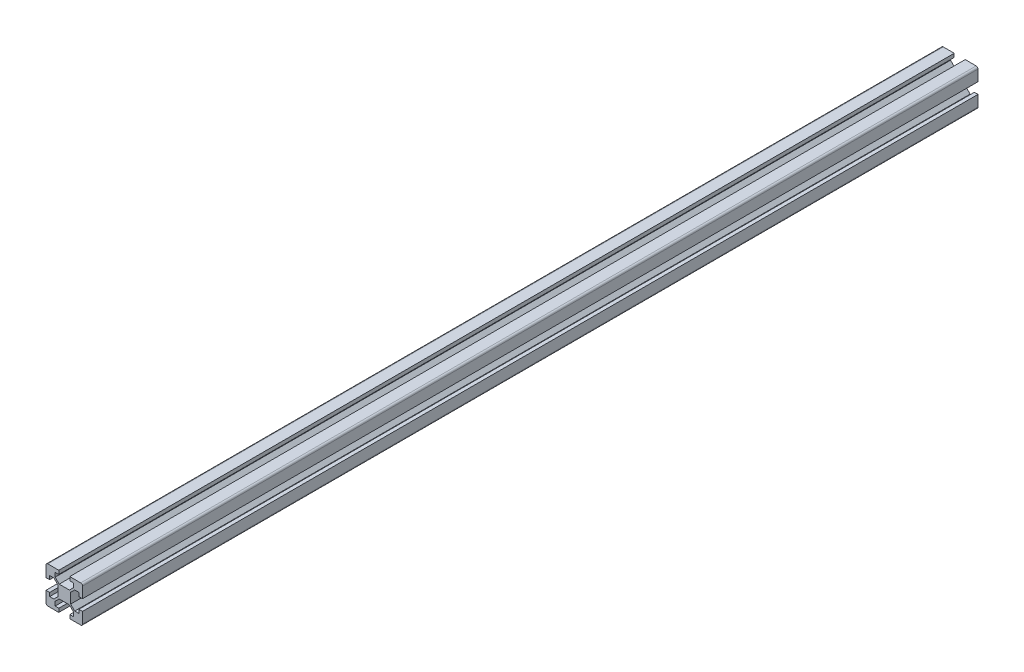
from build123d import *

# Parameters (mm, degrees)
BOSS_EXTRUDE1_DEPTH = 490


with BuildPart() as part:
    # Sketch1 → Boss-Extrude1 (new body)
    with BuildSketch(Plane.XY):
        with BuildLine():
            Line((-9, 10), (-3, 10))
            Line((-3, 10), (-3, 8))
            Line((-3, 8), (-5, 8))
            Line((-5, 8), (-5, 5.707106781))
            Line((-5, 5.707106781), (-2.792893219, 3.5))
            Line((-2.792893219, 3.5), (0, 3.5))
            Line((0, 3.5), (0, 0))
            Line((0, 0), (-3.5, 0))
            Line((-3.5, 0), (-3.5, 2.792893219))
            Line((-3.5, 2.792893219), (-5.707106781, 5))
            Line((-5.707106781, 5), (-8, 5))
            Line((-8, 5), (-8, 3))
            Line((-8, 3), (-10, 3))
            Line((-10, 3), (-10, 9))
            ThreePointArc((-10, 9), (-9.707106781, 9.707106781), (-9, 10))
        make_face()
        with BuildLine():
            Line((9.707106781, 9.707106781), (0, 0))
            Line((0, 0), (3.5, 0))
            Line((3.5, 0), (3.5, 2.792893219))
            Line((3.5, 2.792893219), (5.707106781, 5))
            Line((5.707106781, 5), (8, 5))
            Line((8, 5), (8, 3))
            Line((8, 3), (10, 3))
            Line((10, 3), (10, 9))
            ThreePointArc((10, 9), (9.923879533, 9.382683432), (9.707106781, 9.707106781))
        make_face()
        with BuildLine():
            Line((0, 3.5), (0, 0))
            Line((0, 0), (9.707106781, 9.707106781))
            ThreePointArc((9.707106781, 9.707106781), (9.382683432, 9.923879533), (9, 10))
            Line((9, 10), (3, 10))
            Line((3, 10), (3, 8))
            Line((3, 8), (5, 8))
            Line((5, 8), (5, 5.707106781))
            Line((5, 5.707106781), (2.792893219, 3.5))
            Line((2.792893219, 3.5), (0, 3.5))
        make_face()
        with BuildLine():
            Line((-10, -9), (-10, -3))
            Line((-10, -3), (-8, -3))
            Line((-8, -3), (-8, -5))
            Line((-8, -5), (-5.707106781, -5))
            Line((-5.707106781, -5), (-3.5, -2.792893219))
            Line((-3.5, -2.792893219), (-3.5, 0))
            Line((-3.5, 0), (0, 0))
            Line((0, 0), (0, -3.5))
            Line((0, -3.5), (-2.792893219, -3.5))
            Line((-2.792893219, -3.5), (-5, -5.707106781))
            Line((-5, -5.707106781), (-5, -8))
            Line((-5, -8), (-3, -8))
            Line((-3, -8), (-3, -10))
            Line((-3, -10), (-9, -10))
            ThreePointArc((-9, -10), (-9.707106781, -9.707106781), (-10, -9))
        make_face()
        with BuildLine():
            Line((9, -10), (3, -10))
            Line((3, -10), (3, -8))
            Line((3, -8), (5, -8))
            Line((5, -8), (5, -5.707106781))
            Line((5, -5.707106781), (2.792893219, -3.5))
            Line((2.792893219, -3.5), (0, -3.5))
            Line((0, -3.5), (0, 0))
            Line((0, 0), (3.5, 0))
            Line((3.5, 0), (3.5, -2.792893219))
            Line((3.5, -2.792893219), (5.707106781, -5))
            Line((5.707106781, -5), (8, -5))
            Line((8, -5), (8, -3))
            Line((8, -3), (10, -3))
            Line((10, -3), (10, -9))
            ThreePointArc((10, -9), (9.707106781, -9.707106781), (9, -10))
        make_face()
    extrude(amount=-BOSS_EXTRUDE1_DEPTH)


solid = part.part
